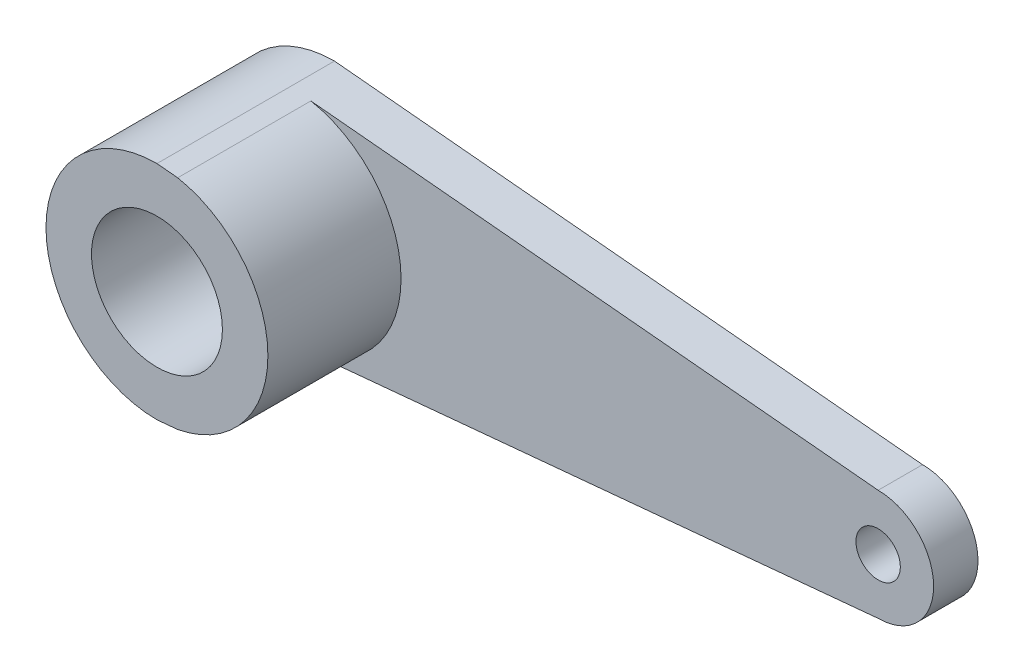
from build123d import *

# Parameters (mm, degrees)
ESQUISSE1_R             = 2.95
ESQUISSE1_R_2           = 1
BOSS_EXTRU_1_DEPTH      = 8
ENL_V_START             = -6
ENL_V_MAT_EXTRU_1_DEPTH = 6


with BuildPart() as part:
    # Esquisse1 → Boss.-Extru.1 (new body)
    with BuildSketch(Plane.XY):
        with BuildLine():
            Line((0, 5), (26.5, 2.5))
            ThreePointArc((26.5, 2.5), (29, 0), (26.5, -2.5))
            Line((26.5, -2.5), (0, -5))
            ThreePointArc((0, -5), (-5, 0), (0, 5))
        make_face()
        Circle(ESQUISSE1_R, mode=Mode.SUBTRACT)
        with Locations((26.5, 0)):
            Circle(ESQUISSE1_R_2, mode=Mode.SUBTRACT)
    extrude(amount=BOSS_EXTRU_1_DEPTH)

    # Esquisse2 → Enlèv. mat.-Extru.1 (cut)
    with BuildSketch(Plane.XY.offset(8).offset(ENL_V_START)):
        with BuildLine():
            Line((26.5, 2.5), (0.9350741, 4.911785462))
            ThreePointArc((0.9350741, 4.911785462), (3.851971606, 3.18783857), (5, 0))
            ThreePointArc((5, 0), (3.851971606, -3.18783857), (0.9350741, -4.911785462))
            Line((0.9350741, -4.911785462), (26.5, -2.5))
            ThreePointArc((26.5, -2.5), (24, 0), (26.5, 2.5))
        make_face()
        with BuildLine():
            ThreePointArc((29, 0), (28.348574488, 1.683084182), (26.73378211, 2.489045183))
            Line((26.73378211, 2.489045183), (26.663377196, 0.986563679))
            ThreePointArc((26.663377196, 0.986563679), (27.262685124, 0.646769976), (27.5, 0))
            ThreePointArc((27.5, 0), (27.231575326, -0.68176062), (26.570404914, -0.997518495))
            Line((26.570404914, -0.997518495), (26.5, -2.5))
            ThreePointArc((26.5, -2.5), (28.267766953, -1.767766953), (29, 0))
        make_face()
        with BuildLine():
            Line((26.663377196, 0.986563679), (26.73378211, 2.489045183))
            ThreePointArc((26.73378211, 2.489045183), (26.617019318, 2.497259794), (26.5, 2.5))
            ThreePointArc((26.5, 2.5), (24, 0), (26.5, -2.5))
            Line((26.5, -2.5), (26.570404914, -0.997518495))
            ThreePointArc((26.570404914, -0.997518495), (25.501096082, 0.046807727), (26.663377196, 0.986563679))
        make_face()
    extrude(amount=ENL_V_MAT_EXTRU_1_DEPTH, mode=Mode.SUBTRACT)


solid = part.part
